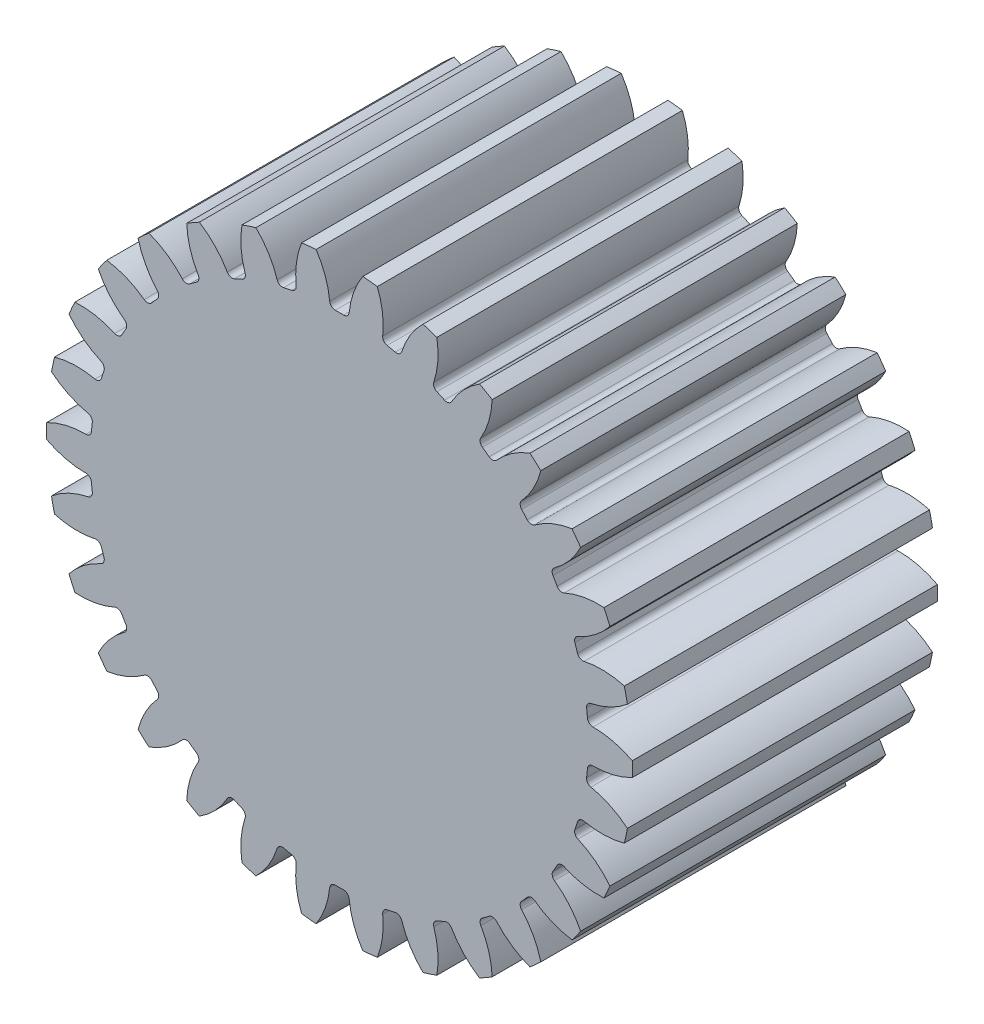
from build123d import *

# Parameters (mm, degrees)
SKETCH1_R                = 19.2
BOSS_EXTRUDE1_DEPTH      = 10
CUT_EXTRUDE1_DEPTH       = 29.935790986
FILLET1_R                = 0.36
CIRPATTERN1_COUNT        = 30
FILLET1_OF_CIRPATTERN1_R = 0.36


with BuildPart() as part:
    # Sketch1 → Boss-Extrude1 (new, symmetric)
    with BuildSketch(Plane.XY):
        Circle(SKETCH1_R)
    extrude(amount=BOSS_EXTRUDE1_DEPTH, both=True)

    # Sketch2 → Cut-Extrude1 (cut, symmetric)
    with BuildSketch(Plane.XY):
        with BuildLine():
            ThreePointArc((-2.310548981, 20.067420447), (-1.095867561, 18.353474883), (-0.615584229, 16.308386065))
            ThreePointArc((-0.615584229, 16.308386065), (0, 16.32), (0.615584229, 16.308386065))
            ThreePointArc((0.615584229, 16.308386065), (1.095867561, 18.353474883), (2.310548981, 20.067420447))
            ThreePointArc((2.310548981, 20.067420447), (0, 20.2), (-2.310548981, 20.067420447))
        make_face()
    cut_extrude1 = extrude(amount=CUT_EXTRUDE1_DEPTH, both=True, mode=Mode.SUBTRACT)

    # Fillet1
    fillet1_edges = [part.edges().sort_by_distance(p)[0] for p in [
        (-0.615584229, 16.308386065, 0),
        (0.615584229, 16.308386065, 0),
    ]]
    fillet(fillet1_edges, radius=FILLET1_R)

    # CirPattern1: Cut-Extrude1 ×30 about axis
    cirpattern1_axis = Axis((0, 0, 0), (0, 0, 1))
    for i in range(1, CIRPATTERN1_COUNT):
        add(cut_extrude1.rotate(cirpattern1_axis, i * 360 / CIRPATTERN1_COUNT), mode=Mode.SUBTRACT)

    # Fillet1 of CirPattern1
    fillet1_of_cirpattern1_edges = [part.edges().sort_by_distance(p)[0] for p in [
        (-3.992836358, 15.824021544, 0),
        (-2.788571884, 16.07999586, 0),
        (-7.195582379, 14.648071349, 0),
        (-6.070854026, 15.148832674, 0),
        (-10.083846921, 12.831930146, 0),
        (-9.087810715, 13.555592809, 0),
        (-12.531398965, 10.454972022, 0),
        (-11.707586468, 11.369908491, 0),
        (-14.431268742, 7.621081452, 0),
        (-13.815684513, 8.687304613, 0),
        (-15.700422826, 4.454113052, 0),
        (-15.319970849, 5.625023838, 0),
        (-16.283393094, 1.092478539, 0),
        (-16.154700947, 2.316902528, 0),
        (-16.154700947, -2.316902528, 0),
        (-16.283393094, -1.092478539, 0),
        (-15.319970849, -5.625023838, 0),
        (-15.700422826, -4.454113052, 0),
        (-13.815684513, -8.687304613, 0),
        (-14.431268742, -7.621081452, 0),
        (-11.707586468, -11.369908491, 0),
        (-12.531398965, -10.454972022, 0),
        (-9.087810715, -13.555592809, 0),
        (-10.083846921, -12.831930146, 0),
        (-6.070854026, -15.148832674, 0),
        (-7.195582379, -14.648071349, 0),
        (-2.788571884, -16.07999586, 0),
        (-3.992836358, -15.824021544, 0),
        (0.615584229, -16.308386065, 0),
        (-0.615584229, -16.308386065, 0),
        (3.992836358, -15.824021544, 0),
        (2.788571884, -16.07999586, 0),
        (7.195582379, -14.648071349, 0),
        (6.070854026, -15.148832674, 0),
        (10.083846921, -12.831930146, 0),
        (9.087810715, -13.555592809, 0),
        (12.531398965, -10.454972022, 0),
        (11.707586468, -11.369908491, 0),
        (14.431268742, -7.621081452, 0),
        (13.815684513, -8.687304613, 0),
        (15.700422826, -4.454113052, 0),
        (15.319970849, -5.625023838, 0),
        (16.283393094, -1.092478539, 0),
        (16.154700947, -2.316902528, 0),
        (16.154700947, 2.316902528, 0),
        (16.283393094, 1.092478539, 0),
        (15.319970849, 5.625023838, 0),
        (15.700422826, 4.454113052, 0),
        (13.815684513, 8.687304613, 0),
        (14.431268742, 7.621081452, 0),
        (11.707586468, 11.369908491, 0),
        (12.531398965, 10.454972022, 0),
        (9.087810715, 13.555592809, 0),
        (10.083846921, 12.831930146, 0),
        (6.070854026, 15.148832674, 0),
        (7.195582379, 14.648071349, 0),
        (2.788571884, 16.07999586, 0),
        (3.992836358, 15.824021544, 0),
    ]]
    fillet(fillet1_of_cirpattern1_edges, radius=FILLET1_OF_CIRPATTERN1_R)


solid = part.part
